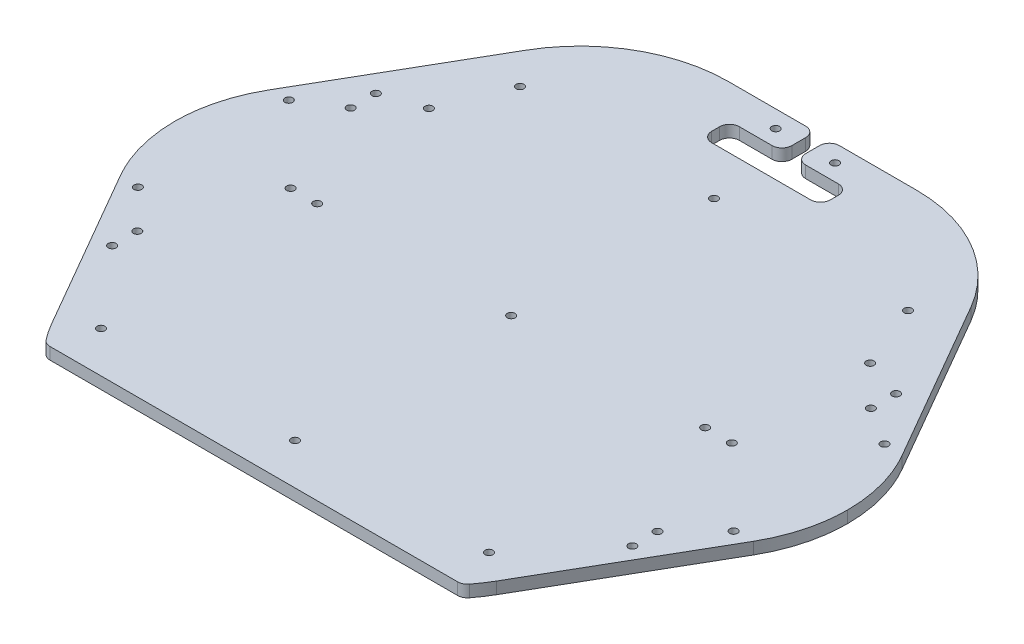
from build123d import *

# Parameters (mm, degrees)
BOSS_EXTRUDE1_DEPTH    = 6
CUT_EXTRUDE1_DEPTH     = 232.66918124
M3_5_CLEARANCE_HOLE1_D = 3.949564791
FILLET1_R              = 5.02065441
FILLET2_R              = 74.958489821


with BuildPart() as part:
    # Sketch1 → Boss-Extrude1 (new body)
    with BuildSketch(Plane(origin=(0, 6, 0), x_dir=(1, 0, 0), z_dir=(0, 1, 0))):
        with BuildLine():
            Line((112.451900879, -119.772412512), (159.951903815, -37.500000848))
            add(Edge.make_bspline(
                [(159.951903815, -37.500000848), (162.089841538, -33.796778918), (165.842589826, -25.786061926), (169.244511458, -13.089917553), (169.999894602, -4.276058992), (169.999997188, -5.864e-06)],
                knots=[2.617993882, 2.617993882, 2.617993882, 2.617993882, 2.789036145, 2.970550387, 3.141592649, 3.141592649, 3.141592649, 3.141592649], degree=3))
            add(Edge.make_bspline(
                [(169.999997188, -5.864e-06), (169.999894602, 4.276047264), (169.244511458, 13.089905825), (165.842589826, 25.786050198), (162.089841538, 33.79676719), (159.951903815, 37.49998912)],
                knots=[3.141592658, 3.141592658, 3.141592658, 3.141592658, 3.31263492, 3.494149162, 3.665191425, 3.665191425, 3.665191425, 3.665191425], degree=3))
            Line((159.951903815, 37.49998912), (90.801278878, 157.272408343))
            Line((90.801278878, 157.272408343), (-90.8012615, 157.272408343))
            Line((-90.8012615, 157.272408343), (-159.951896595, 37.499994984))
            add(Edge.make_bspline(
                [(-159.951896595, 37.499994984), (-162.089834317, 33.796773054), (-165.842582605, 25.786056062), (-169.244504237, 13.08991169), (-169.999887381, 4.276053128), (-169.999989967, 0)],
                knots=[5.759586536, 5.759586536, 5.759586536, 5.759586536, 5.930628798, 6.11214304, 6.283185303, 6.283185303, 6.283185303, 6.283185303], degree=3))
            add(Edge.make_bspline(
                [(-169.999989967, 0), (-169.999887381, -4.276053128), (-169.244504237, -13.089911689), (-165.842582605, -25.786056062), (-162.089834317, -33.796773054), (-159.951896595, -37.499994984)],
                knots=[6.283185312, 6.283185312, 6.283185312, 6.283185312, 6.454227574, 6.635741816, 6.806784078, 6.806784078, 6.806784078, 6.806784078], degree=3))
            Line((-159.951896595, -37.499994984), (-112.451903815, -119.772412512))
            add(Edge.make_bspline(
                [(-112.451903815, -119.772412512), (-110.697042547, -122.811840435), (-108.72856528, -125.72791615), (-106.565705299, -128.491919084), (-106.17234227, -128.994613005), (-105.778979241, -129.497306926), (-105.385616213, -130.000000848)],
                knots=[0.523598778, 0.523598778, 0.523598778, 0.523598778, 0.663984963, 0.663984963, 0.663984963, 0.689517237, 0.689517237, 0.689517237, 0.689517237], degree=3))
            Line((-105.385616213, -130.000000848), (105.385613276, -130.000000848))
            add(Edge.make_bspline(
                [(105.385613276, -130.000000848), (105.778976305, -129.497306926), (106.172339333, -128.994613005), (106.565702362, -128.491919084), (108.728562343, -125.72791615), (110.69703961, -122.811840435), (112.451900879, -119.772412512)],
                knots=[2.452075416, 2.452075416, 2.452075416, 2.452075416, 2.477607691, 2.477607691, 2.477607691, 2.617993876, 2.617993876, 2.617993876, 2.617993876], degree=3))
        make_face()
    extrude(amount=-BOSS_EXTRUDE1_DEPTH)

    # Sketch2 → Cut-Extrude1 (cut, through all)
    with BuildSketch(Plane.XZ):
        Polygon((3.5, -157.27241336), (3.5, -140.27241336), (30, -140.27241336), (30, -126.27241336), (-30, -126.27241336), (-30, -140.27241336), (-3.5, -140.27241336), (-3.5, -157.27241336), align=None)
    extrude(amount=-CUT_EXTRUDE1_DEPTH, mode=Mode.SUBTRACT)

    # M3.5 Clearance Hole1 (through all)
    with Locations(Plane(origin=(0, 0, 0), x_dir=(-1, 0, 0), z_dir=(0, -1, 0))):
        with Locations((98, -109.219962871), (-98, 102.438237129), (98, 102.438237129), (0, 102.438237129), (0, -109.219962871), (0, 3.7129e-05), (-97.9932, -3.7129e-05), (97.9932, -3.7129e-05), (111.4552, 69.849962871), (111.4552, -3.7129e-05), (-111.4552, 69.849962871), (-111.4552, -3.7129e-05), (-98, -109.219962871), (131.4, 50.300037129), (-131.4, 50.300037129), (131.4, -70.199962871), (-131.4, -70.199962871), (131.4, 63.000037129), (-131.4, 63.000037129), (131.4, -57.499962871), (-131.4, -57.499962871), (15, 148.600037129), (-15, 148.600037129), (150.47, 38.100037129), (150.47, -38.099962871), (-150.47, 38.100037129), (-150.47, -38.099962871)):
            Hole(M3_5_CLEARANCE_HOLE1_D / 2)

    # Fillet1
    fillet1_edges = [part.edges().sort_by_distance(p)[0] for p in [
        (-105.385616213, 3, 130.000000848),
        (3.5, 3, -140.27241336),
        (-3.5, 3, -157.272408343),
        (-30, 3, -126.27241336),
        (3.5, 3, -157.272408343),
        (-30, 3, -140.27241336),
        (-3.5, 3, -140.27241336),
        (30, 3, -140.27241336),
        (105.385613276, 3, 130.000000848),
        (30, 3, -126.27241336),
    ]]
    fillet(fillet1_edges, radius=FILLET1_R)

    # Fillet2
    fillet2_edges = [part.edges().sort_by_distance(p)[0] for p in [
        (90.801278878, 3, -157.272408343),
        (-90.8012615, 3, -157.272408343),
    ]]
    fillet(fillet2_edges, radius=FILLET2_R)


solid = part.part
